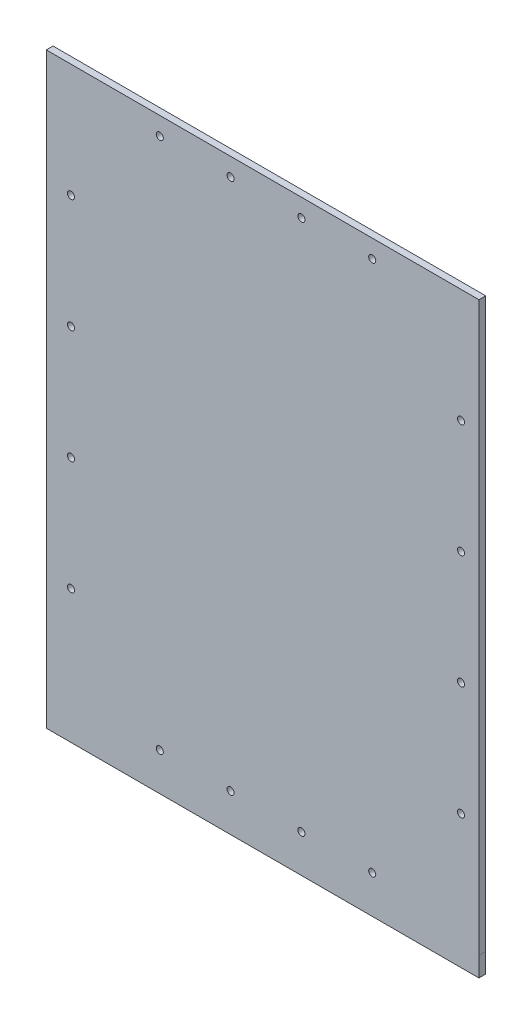
from build123d import *

# Parameters (mm, degrees)
SKETCH_1_W                     = 305.55
SKETCH_1_H                     = 405.55
EXTRUDE_1_DEPTH                = 4.75
SKETCH_3_R                     = 2.5
CUT_EXTRUDE_1_DEPTH            = 10
SKETCH_5_R                     = 2.5
CUT_EXTRUDE_3_DEPTH            = 10
SKETCH_6_R                     = 2.5
CUT_EXTRUDE_4_DEPTH            = 10
SKETCH_7_R                     = 2.5
CUT_EXTRUDE_5_DEPTH            = 10
SPLIT_BODIES_1_SURFACE_1_BACK  = 508.793
SPLIT_BODIES_1_SURFACE_1_DEPTH = 1017.586
SKETCH_9_W                     = 305.5
SKETCH_9_H                     = 14
EXTRUDE_2_DEPTH                = 4.75


with BuildPart() as part:
    # 草圖1 → 填料-伸長1 (new body)
    with BuildSketch(Plane.XY):
        Rectangle(SKETCH_1_W, SKETCH_1_H)
    extrude(amount=EXTRUDE_1_DEPTH)

    # 草圖3 → 除料-伸長1 (cut)
    with BuildSketch(Plane.XY.offset(4.75)):
        with Locations((140.075, 37.705)):
            Circle(SKETCH_3_R)
        with Locations((140.075, 117.865)):
            Circle(SKETCH_3_R)
        with Locations((140.075, -42.455)):
            Circle(SKETCH_3_R)
        with Locations((140.075, -122.615)):
            Circle(SKETCH_3_R)
    extrude(amount=-CUT_EXTRUDE_1_DEPTH, mode=Mode.SUBTRACT)

    # 草圖5 → 除料-伸長3 (cut)
    with BuildSketch(Plane.XY.offset(4.75)):
        with Locations((-135.325, -122.615)):
            Circle(SKETCH_5_R)
        with Locations((-135.325, -42.455)):
            Circle(SKETCH_5_R)
        with Locations((-135.325, 37.705)):
            Circle(SKETCH_5_R)
        with Locations((-135.325, 117.865)):
            Circle(SKETCH_5_R)
    extrude(amount=-CUT_EXTRUDE_3_DEPTH, mode=Mode.SUBTRACT)

    # 草圖6 → 除料-伸長4 (cut)
    with BuildSketch(Plane(origin=(0, 0, 0), x_dir=(-1, 0, 0), z_dir=(0, 0, -1))):
        with Locations((22.625, 185.325)):
            Circle(SKETCH_6_R)
        with Locations((72.625, 185.325)):
            Circle(SKETCH_6_R)
        with Locations((-77.375, 185.325)):
            Circle(SKETCH_6_R)
        with Locations((-27.375, 185.325)):
            Circle(SKETCH_6_R)
    extrude(amount=-CUT_EXTRUDE_4_DEPTH, mode=Mode.SUBTRACT)

    # 草圖7 → 除料-伸長5 (cut)
    with BuildSketch(Plane(origin=(0, 0, 0), x_dir=(-1, 0, 0), z_dir=(0, 0, -1))):
        with Locations((-77.375, -190.075)):
            Circle(SKETCH_7_R)
        with Locations((-27.375, -190.075)):
            Circle(SKETCH_7_R)
        with Locations((22.625, -190.075)):
            Circle(SKETCH_7_R)
        with Locations((72.625, -190.075)):
            Circle(SKETCH_7_R)
    extrude(amount=-CUT_EXTRUDE_5_DEPTH, mode=Mode.SUBTRACT)

    # Split Bodies 1: cut with a surface, the side it looks to stays
    # Split Bodies 1 surface: a surface, the sketch's curves swept straight by 1017.586 mm
    with BuildLine(Plane.XY.offset(4.75).offset(-SPLIT_BODIES_1_SURFACE_1_BACK), mode=Mode.PRIVATE) as split_bodies_1_surface_1_path:
        Line((-152.775, 202.775), (152.775, 202.775))
        Line((152.775, 202.775), (152.775, 198.025))
        Line((152.775, 198.025), (-152.775, 198.025))
        Line((-152.775, 198.025), (-152.775, 202.775))
    split_bodies_1_surface_1 = Shell.extrude(split_bodies_1_surface_1_path.wire(), (0 * SPLIT_BODIES_1_SURFACE_1_DEPTH, 0 * SPLIT_BODIES_1_SURFACE_1_DEPTH, 1 * SPLIT_BODIES_1_SURFACE_1_DEPTH))
    split(bisect_by=split_bodies_1_surface_1, keep=Keep.TOP)

    # 草圖9 → 填料-伸長2 (add)
    with BuildSketch(Plane.XY):
        with Locations((-0.025, -209.775)):
            Rectangle(SKETCH_9_W, SKETCH_9_H)
    extrude(amount=EXTRUDE_2_DEPTH)


solid = part.part
